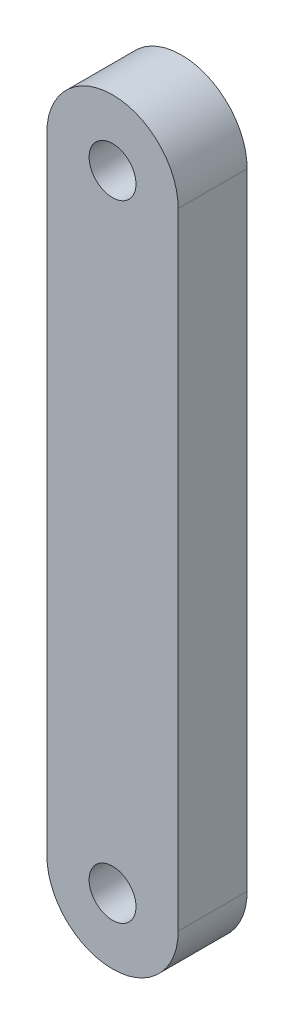
from build123d import *

# Parameters (mm, degrees)
SKETCH1_R           = 1.7
BOSS_EXTRUDE1_DEPTH = 5


with BuildPart() as part:
    # Sketch1 → Boss-Extrude1 (new body)
    with BuildSketch(Plane.XY):
        with BuildLine():
            Line((-4.762315653, 14.483898553), (-4.762315653, 59.865668381))
            ThreePointArc((-4.762315653, 59.865668381), (0, 64.627984033), (4.762315653, 59.865668381))
            Line((4.762315653, 59.865668381), (4.762315653, 14.483898553))
            ThreePointArc((4.762315653, 14.483898553), (0, 9.721582901), (-4.762315653, 14.483898553))
        make_face()
        with Locations((0, 59.865668381)):
            Circle(SKETCH1_R, mode=Mode.SUBTRACT)
        with Locations((0, 14.483898553)):
            Circle(SKETCH1_R, mode=Mode.SUBTRACT)
    extrude(amount=BOSS_EXTRUDE1_DEPTH)


solid = part.part
